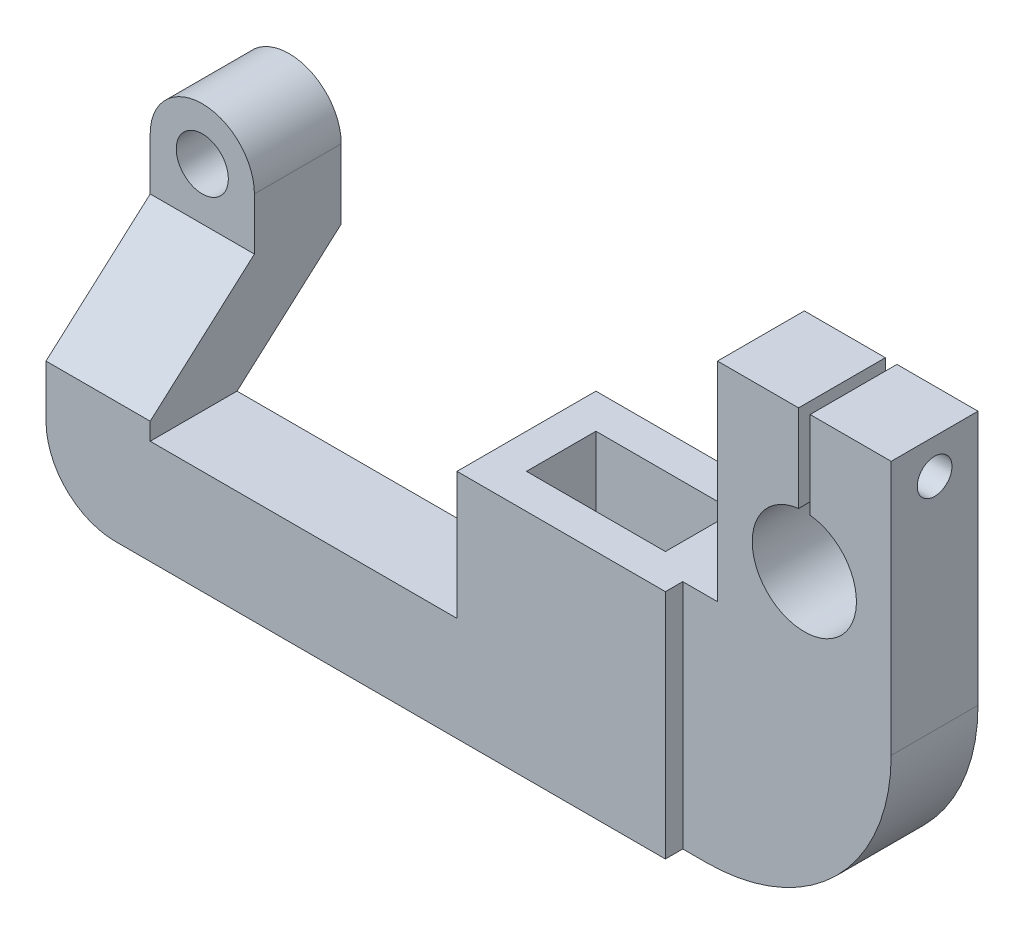
from build123d import *

# Parameters (mm, degrees)
SKETCH2_R            = 4.5
BOSS_EXTRUDE1_DEPTH  = 15
SKETCH6_W            = 18
SKETCH6_H            = 16
SKETCH6_H_2          = 3
BOSS_EXTRUDE9_DEPTH  = 33
CUT_EXTRUDE2_DEPTH   = 33
BOSS_EXTRUDE11_DEPTH = 15
BOSS_EXTRUDE13_DEPTH = 24
SKETCH20_W           = 24
SKETCH20_H           = 12
CUT_EXTRUDE3_DEPTH   = 57
BOSS_EXTRUDE15_DEPTH = 15
SKETCH22_R           = 3
CUT_EXTRUDE4_DEPTH   = 47


with BuildPart() as part:
    # Sketch2 → Boss-Extrude1 (new body)
    with BuildSketch(Plane.XY):
        with BuildLine():
            Line((-78.062958061, 34.644624266), (-78.062958061, 25.644624266))
            Line((-78.062958061, 25.644624266), (-60.062958061, 25.644624266))
            Line((-60.062958061, 25.644624266), (-60.062958061, 34.644624266))
            ThreePointArc((-60.062958061, 34.644624266), (-69.062958061, 43.644624266), (-78.062958061, 34.644624266))
        make_face()
        with Locations((-69.062958061, 34.644624266)):
            Circle(SKETCH2_R, mode=Mode.SUBTRACT)
    extrude(amount=-BOSS_EXTRUDE1_DEPTH)

    # Sketch6 → Boss-Extrude9 (add)
    with BuildSketch(Plane(origin=(0, 0, -15), x_dir=(-1, 0, 0), z_dir=(0, 0, -1))):
        with Locations((69.062958061, 14.644624266)):
            Rectangle(SKETCH6_W, SKETCH6_H)
        with Locations((69.062958061, 24.144624266)):
            Rectangle(SKETCH6_W, SKETCH6_H_2)
    extrude(amount=-BOSS_EXTRUDE9_DEPTH)

    # Sketch15 → Cut-Extrude2 (cut)
    with BuildSketch(Plane.ZY.offset(78.062958061)):
        Polygon((-15, 6.644624266), (-15, 22.644624266), (3, 6.644624266), align=None)
        Polygon((18, 9.644624266), (0, 25.644624266), (18, 25.644624266), align=None)
    extrude(amount=-CUT_EXTRUDE2_DEPTH, mode=Mode.SUBTRACT)

    # Sketch16 → Boss-Extrude11 (add)
    with BuildSketch(Plane.XY.offset(18)):
        with BuildLine():
            Line((-78.062958061, 6.644624266), (-78.062958061, 0.644624266))
            ThreePointArc((-78.062958061, 0.644624266), (-74.548239436, -7.840657108), (-66.062958061, -11.355375734))
            Line((-66.062958061, -11.355375734), (-7.062958061, -11.355375734))
            Line((-7.062958061, -11.355375734), (-7.062958061, 6.644624266))
            Line((-7.062958061, 6.644624266), (-78.062958061, 6.644624266))
        make_face()
    extrude(amount=-BOSS_EXTRUDE11_DEPTH)

    # Sketch18 → Boss-Extrude13 (add)
    with BuildSketch(Plane.XY.offset(18)):
        Polygon((28.937041939, -11.355375734), (-7.062958061, -11.355375734), (-7.062958061, 6.644624266), (-7.062958061, 28.644624266), (28.937041939, 28.644624266), align=None)
    extrude(amount=-BOSS_EXTRUDE13_DEPTH)

    # Sketch20 → Cut-Extrude3 (cut)
    with BuildSketch(Plane(origin=(0, 28.644624266, 0), x_dir=(1, 0, 0), z_dir=(0, 1, 0))):
        with Locations((10.937041939, -6)):
            Rectangle(SKETCH20_W, SKETCH20_H)
    extrude(amount=-CUT_EXTRUDE3_DEPTH, mode=Mode.SUBTRACT)

    # Sketch21 → Boss-Extrude15 (add)
    with BuildSketch(Plane.XY):
        with BuildLine():
            Line((22.937041939, 28.644624266), (34.937041939, 28.644624266))
            Line((34.937041939, 28.644624266), (34.937041939, 64.644624266))
            Line((34.937041939, 64.644624266), (48.937041939, 64.644624266))
            Line((48.937041939, 64.644624266), (48.937041939, 49.588896176))
            ThreePointArc((48.937041939, 49.588896176), (49.937041939, 31.644624266), (50.937041939, 49.588896176))
            Line((50.937041939, 49.588896176), (50.937041939, 64.644624266))
            Line((50.937041939, 64.644624266), (64.937041939, 64.644624266))
            Line((64.937041939, 64.644624266), (64.937041939, 20.644624266))
            ThreePointArc((64.937041939, 20.644624266), (55.564458937, -1.982792732), (32.937041939, -11.355375734))
            Line((32.937041939, -11.355375734), (22.937041939, -11.355375734))
            Line((22.937041939, -11.355375734), (22.937041939, 28.644624266))
        make_face()
    extrude(amount=BOSS_EXTRUDE15_DEPTH)

    # Sketch22 → Cut-Extrude4 (cut)
    with BuildSketch(Plane(origin=(64.937041939, 0, 0), x_dir=(0, 0, -1), z_dir=(1, 0, 0))):
        with Locations((-7.5, 58.644624266)):
            Circle(SKETCH22_R)
    extrude(amount=-CUT_EXTRUDE4_DEPTH, mode=Mode.SUBTRACT)


solid = part.part
